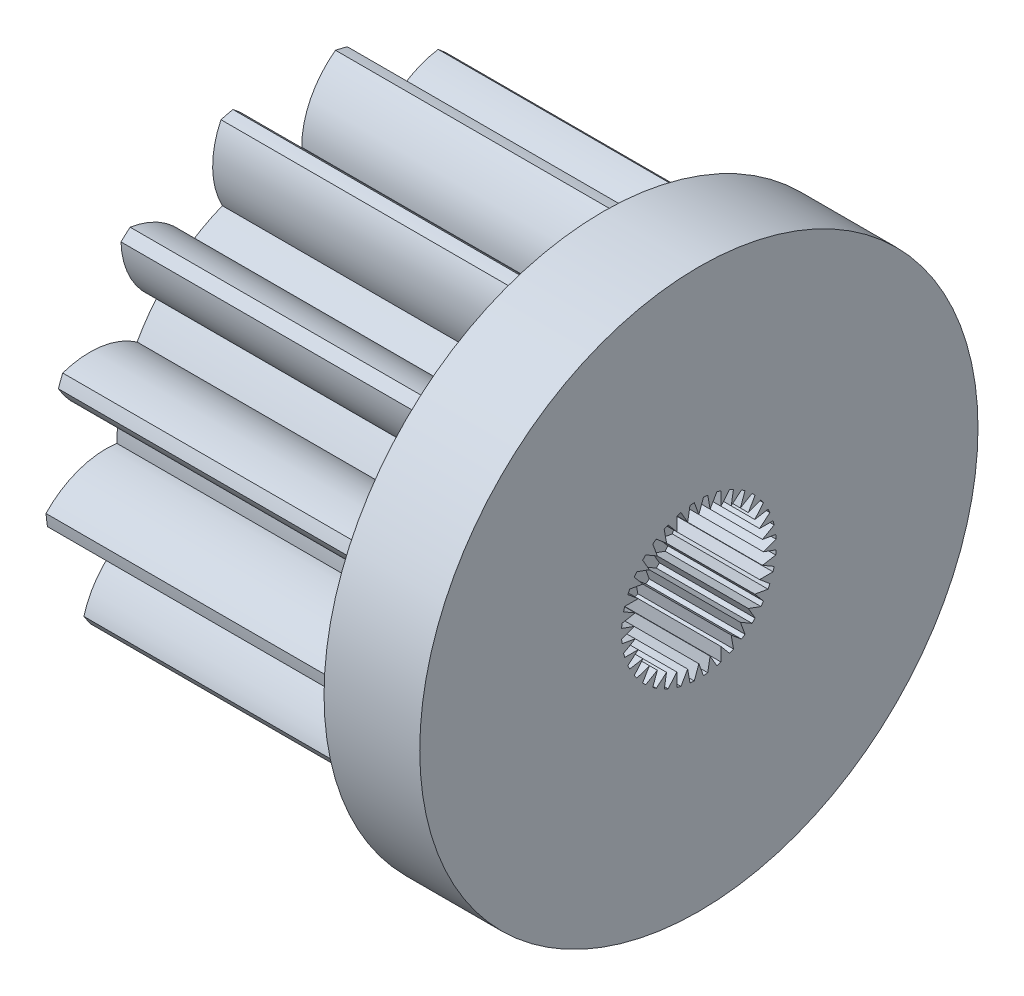
from build123d import *

# Parameters (mm, degrees)
SKETCH1_W                      = 3
SKETCH1_H                      = 8.75
BOSS_EXTRUDE1_DEPTH            = 10
CUT_EXTRUDE1_DEPTH             = 3
F_1_6_1_6_DIAMETER_HOLE1_D     = 1.6
F_1_6_1_6_DIAMETER_HOLE1_DEPTH = 13


with BuildPart() as part:
    # Sketch1 → Revolve1 (revolve)
    with BuildSketch(Plane(origin=(0, 0, 0), x_dir=(-1, 0, 0), z_dir=(0, 0, -1)), mode=Mode.PRIVATE) as revolve1_sk:
        with Locations((-11.5, 4.375)):
            Rectangle(SKETCH1_W, SKETCH1_H)
    revolve(revolve1_sk.sketch.rotate(Axis((13, 0, 0), (-1, 0, 0)), 270), axis=Axis((13, 0, 0), (-1, 0, 0)))

    # Sketch2 → Boss-Extrude1 (add)
    with BuildSketch(Plane.ZY.offset(-10)):
        with BuildLine():
            ThreePointArc((3.983306334, 3.41837266), (4.319842312, 2.981771856), (4.608733854, 2.512284471))
            ThreePointArc((4.608733854, 2.512284471), (5.736412412, 2.954786958), (6.942190227, 2.838308449))
            ThreePointArc((6.942190227, 2.838308449), (7.01262182, 2.659536653), (7.078450644, 2.479019256))
            ThreePointArc((7.078450644, 2.479019256), (6.253152529, 1.592255251), (5.115639582, 1.175683915))
            ThreePointArc((5.115639582, 1.175683915), (5.21072888, 0.632697035), (5.24834797, 0.082732007))
            ThreePointArc((5.24834797, 0.082732007), (6.452498904, -0.049509856), (7.466031873, -0.712999344))
            ThreePointArc((7.466031873, -0.712999344), (7.445316556, -0.904025102), (7.419714468, -1.094457498))
            ThreePointArc((7.419714468, -1.094457498), (6.276849497, -1.496112872), (5.076041451, -1.336339847))
            ThreePointArc((5.076041451, -1.336339847), (4.907900258, -1.861321052), (4.685628816, -2.365773362))
            ThreePointArc((4.685628816, -2.365773362), (5.690395658, -3.042464558), (6.279495593, -4.10096758))
            ThreePointArc((6.279495593, -4.10096758), (6.172378994, -4.2604856), (6.061211124, -4.41720723))
            ThreePointArc((6.061211124, -4.41720723), (4.862595889, -4.241739566), (3.873583397, -3.542224254))
            ThreePointArc((3.873583397, -3.542224254), (3.480730833, -3.928932917), (3.049488568, -4.272308565))
            ThreePointArc((3.049488568, -4.272308565), (3.624691343, -5.338427296), (3.654402549, -6.549453566))
            ThreePointArc((3.654402549, -6.549453566), (3.48542379, -6.640920192), (3.314157357, -6.728028018))
            ThreePointArc((3.314157357, -6.728028018), (2.334380164, -6.015634844), (1.783734068, -4.936627773))
            ThreePointArc((1.783734068, -4.936627773), (1.256167922, -5.0964736), (0.714747239, -5.200109363))
            ThreePointArc((0.714747239, -5.200109363), (0.728613924, -6.411420676), (0.192129921, -7.497538669))
            ThreePointArc((0.192129921, -7.497538669), (0, -7.5), (-0.192129921, -7.497538669))
            ThreePointArc((-0.192129921, -7.497538669), (-0.728613924, -6.411420676), (-0.714747239, -5.200109363))
            ThreePointArc((-0.714747239, -5.200109363), (-1.256167922, -5.0964736), (-1.783734068, -4.936627773))
            ThreePointArc((-1.783734068, -4.936627773), (-2.334380164, -6.015634844), (-3.314157357, -6.728028018))
            ThreePointArc((-3.314157357, -6.728028018), (-3.48542379, -6.640920192), (-3.654402549, -6.549453566))
            ThreePointArc((-3.654402549, -6.549453566), (-3.624691343, -5.338427296), (-3.049488568, -4.272308565))
            ThreePointArc((-3.049488568, -4.272308565), (-3.480730833, -3.928932917), (-3.873583397, -3.542224254))
            ThreePointArc((-3.873583397, -3.542224254), (-4.862595889, -4.241739566), (-6.061211124, -4.41720723))
            ThreePointArc((-6.061211124, -4.41720723), (-6.172378994, -4.2604856), (-6.279495593, -4.10096758))
            ThreePointArc((-6.279495593, -4.10096758), (-5.690395658, -3.042464558), (-4.685628816, -2.365773362))
            ThreePointArc((-4.685628816, -2.365773362), (-4.907900258, -1.861321052), (-5.076041451, -1.336339847))
            ThreePointArc((-5.076041451, -1.336339847), (-6.276849497, -1.496112872), (-7.419714468, -1.094457498))
            ThreePointArc((-7.419714468, -1.094457498), (-7.445316556, -0.904025102), (-7.466031873, -0.712999344))
            ThreePointArc((-7.466031873, -0.712999344), (-6.452498904, -0.049509856), (-5.24834797, 0.082732007))
            ThreePointArc((-5.24834797, 0.082732007), (-5.21072888, 0.632697035), (-5.115639582, 1.175683915))
            ThreePointArc((-5.115639582, 1.175683915), (-6.253152529, 1.592255251), (-7.078450644, 2.479019256))
            ThreePointArc((-7.078450644, 2.479019256), (-7.01262182, 2.659536653), (-6.942190227, 2.838308449))
            ThreePointArc((-6.942190227, 2.838308449), (-5.736412412, 2.954786958), (-4.608733854, 2.512284471))
            ThreePointArc((-4.608733854, 2.512284471), (-4.319842312, 2.981771856), (-3.983306334, 3.41837266))
            ThreePointArc((-3.983306334, 3.41837266), (-4.796933675, 4.315856884), (-5.115599083, 5.484582575))
            ThreePointArc((-5.115599083, 5.484582575), (-4.973419937, 5.613830611), (-4.827976462, 5.739393982))
            ThreePointArc((-4.827976462, 5.739393982), (-3.706182968, 5.282177689), (-2.913314353, 4.366302839))
            ThreePointArc((-2.913314353, 4.366302839), (-2.43933193, 4.647758679), (-1.93844561, 4.877953425))
            ThreePointArc((-1.93844561, 4.877953425), (-2.241795126, 6.050747718), (-1.980825421, 7.233694122))
            ThreePointArc((-1.980825421, 7.233694122), (-1.794867482, 7.282063631), (-1.607731473, 7.325653521))
            ThreePointArc((-1.607731473, 7.325653521), (-0.82691167, 6.399485168), (-0.550489643, 5.220053846))
            ThreePointArc((-0.550489643, 5.220053846), (0, 5.249), (0.550489643, 5.220053846))
            ThreePointArc((0.550489643, 5.220053846), (0.82691167, 6.399485168), (1.607731473, 7.325653521))
            ThreePointArc((1.607731473, 7.325653521), (1.794867482, 7.282063631), (1.980825421, 7.233694122))
            ThreePointArc((1.980825421, 7.233694122), (2.241795126, 6.050747718), (1.93844561, 4.877953425))
            ThreePointArc((1.93844561, 4.877953425), (2.43933193, 4.647758679), (2.913314353, 4.366302839))
            ThreePointArc((2.913314353, 4.366302839), (3.706182968, 5.282177689), (4.827976462, 5.739393982))
            ThreePointArc((4.827976462, 5.739393982), (4.973419937, 5.613830611), (5.115599083, 5.484582575))
            ThreePointArc((5.115599083, 5.484582575), (4.796933675, 4.315856884), (3.983306334, 3.41837266))
        make_face()
    extrude(amount=BOSS_EXTRUDE1_DEPTH)

    # Sketch3 → Cut-Extrude1 (cut)
    with BuildSketch(Plane(origin=(13, 0, 0), x_dir=(0, 0, -1), z_dir=(1, 0, 0))):
        with BuildLine():
            Line((0, -2.025), (0.14402993, -2.42071898))
            ThreePointArc((0.14402993, -2.42071898), (0.211352676, -2.415772143), (0.278511648, -2.408953354))
            Line((0.278511648, -2.408953354), (0.35163756, -1.9942357))
            Line((0.35163756, -1.9942357), (0.562195231, -2.358932284))
            ThreePointArc((0.562195231, -2.358932284), (0.627636184, -2.342370129), (0.69259079, -2.3239929))
            Line((0.69259079, -2.3239929), (0.69259079, -1.902877557))
            Line((0.69259079, -1.902877557), (0.963278515, -2.225470625))
            ThreePointArc((0.963278515, -2.225470625), (1.024849285, -2.197796384), (1.085625912, -2.168419097))
            Line((1.085625912, -2.168419097), (1.0125, -1.753701443))
            Line((1.0125, -1.753701443), (1.335093068, -2.024389167))
            ThreePointArc((1.335093068, -2.024389167), (1.390922858, -1.986443707), (1.44567484, -1.946958977))
            Line((1.44567484, -1.946958977), (1.30164491, -1.551239997))
            Line((1.30164491, -1.551239997), (1.666341494, -1.761797668))
            ThreePointArc((1.666341494, -1.761797668), (1.714733944, -1.714733944), (1.761797669, -1.666341494))
            Line((1.761797669, -1.666341494), (1.551239997, -1.30164491))
            Line((1.551239997, -1.30164491), (1.946958977, -1.445674839))
            ThreePointArc((1.946958977, -1.445674839), (1.986443707, -1.390922858), (2.024389167, -1.335093068))
            Line((2.024389167, -1.335093068), (1.753701443, -1.0125))
            Line((1.753701443, -1.0125), (2.168419097, -1.085625912))
            ThreePointArc((2.168419097, -1.085625912), (2.197796384, -1.024849285), (2.225470625, -0.963278515))
            Line((2.225470625, -0.963278515), (1.902877557, -0.69259079))
            Line((1.902877557, -0.69259079), (2.3239929, -0.69259079))
            ThreePointArc((2.3239929, -0.69259079), (2.342370129, -0.627636184), (2.358932284, -0.562195231))
            Line((2.358932284, -0.562195231), (1.9942357, -0.35163756))
            Line((1.9942357, -0.35163756), (2.408953354, -0.278511648))
            ThreePointArc((2.408953354, -0.278511648), (2.415772143, -0.211352676), (2.42071898, -0.14402993))
            Line((2.42071898, -0.14402993), (2.025, 0))
            Line((2.025, 0), (2.42071898, 0.14402993))
            ThreePointArc((2.42071898, 0.14402993), (2.415772143, 0.211352676), (2.408953354, 0.278511648))
            Line((2.408953354, 0.278511648), (1.9942357, 0.35163756))
            Line((1.9942357, 0.35163756), (2.358932284, 0.562195231))
            ThreePointArc((2.358932284, 0.562195231), (2.342370129, 0.627636184), (2.3239929, 0.69259079))
            Line((2.3239929, 0.69259079), (1.902877557, 0.69259079))
            Line((1.902877557, 0.69259079), (2.225470625, 0.963278515))
            ThreePointArc((2.225470625, 0.963278515), (2.197796384, 1.024849285), (2.168419097, 1.085625912))
            Line((2.168419097, 1.085625912), (1.753701443, 1.0125))
            Line((1.753701443, 1.0125), (2.024389167, 1.335093068))
            ThreePointArc((2.024389167, 1.335093068), (1.986443707, 1.390922858), (1.946958977, 1.445674839))
            Line((1.946958977, 1.445674839), (1.551239997, 1.30164491))
            Line((1.551239997, 1.30164491), (1.761797669, 1.666341494))
            ThreePointArc((1.761797669, 1.666341494), (1.714733944, 1.714733944), (1.666341494, 1.761797669))
            Line((1.666341494, 1.761797669), (1.30164491, 1.551239997))
            Line((1.30164491, 1.551239997), (1.445674839, 1.946958977))
            ThreePointArc((1.445674839, 1.946958977), (1.390922858, 1.986443707), (1.335093068, 2.024389167))
            Line((1.335093068, 2.024389167), (1.0125, 1.753701443))
            Line((1.0125, 1.753701443), (1.085625912, 2.168419097))
            ThreePointArc((1.085625912, 2.168419097), (1.024849285, 2.197796384), (0.963278515, 2.225470625))
            Line((0.963278515, 2.225470625), (0.69259079, 1.902877557))
            Line((0.69259079, 1.902877557), (0.69259079, 2.3239929))
            ThreePointArc((0.69259079, 2.3239929), (0.627636184, 2.342370129), (0.562195231, 2.358932284))
            Line((0.562195231, 2.358932284), (0.35163756, 1.9942357))
            Line((0.35163756, 1.9942357), (0.278511648, 2.408953354))
            ThreePointArc((0.278511648, 2.408953354), (0.211352676, 2.415772143), (0.14402993, 2.42071898))
            Line((0.14402993, 2.42071898), (0, 2.025))
            Line((0, 2.025), (-0.14402993, 2.42071898))
            ThreePointArc((-0.14402993, 2.42071898), (-0.211352676, 2.415772143), (-0.278511648, 2.408953354))
            Line((-0.278511648, 2.408953354), (-0.35163756, 1.9942357))
            Line((-0.35163756, 1.9942357), (-0.562195231, 2.358932284))
            ThreePointArc((-0.562195231, 2.358932284), (-0.627636184, 2.342370129), (-0.69259079, 2.3239929))
            Line((-0.69259079, 2.3239929), (-0.69259079, 1.902877557))
            Line((-0.69259079, 1.902877557), (-0.963278515, 2.225470625))
            ThreePointArc((-0.963278515, 2.225470625), (-1.024849285, 2.197796384), (-1.085625912, 2.168419097))
            Line((-1.085625912, 2.168419097), (-1.0125, 1.753701443))
            Line((-1.0125, 1.753701443), (-1.335093068, 2.024389167))
            ThreePointArc((-1.335093068, 2.024389167), (-1.390922858, 1.986443707), (-1.445674839, 1.946958977))
            Line((-1.445674839, 1.946958977), (-1.30164491, 1.551239997))
            Line((-1.30164491, 1.551239997), (-1.666341494, 1.761797669))
            ThreePointArc((-1.666341494, 1.761797669), (-1.714733944, 1.714733944), (-1.761797669, 1.666341494))
            Line((-1.761797669, 1.666341494), (-1.551239997, 1.30164491))
            Line((-1.551239997, 1.30164491), (-1.946958977, 1.445674839))
            ThreePointArc((-1.946958977, 1.445674839), (-1.986443707, 1.390922858), (-2.024389167, 1.335093068))
            Line((-2.024389167, 1.335093068), (-1.753701443, 1.0125))
            Line((-1.753701443, 1.0125), (-2.168419097, 1.085625912))
            ThreePointArc((-2.168419097, 1.085625912), (-2.197796384, 1.024849285), (-2.225470625, 0.963278515))
            Line((-2.225470625, 0.963278515), (-1.902877557, 0.69259079))
            Line((-1.902877557, 0.69259079), (-2.3239929, 0.69259079))
            ThreePointArc((-2.3239929, 0.69259079), (-2.342370129, 0.627636184), (-2.358932284, 0.562195231))
            Line((-2.358932284, 0.562195231), (-1.9942357, 0.35163756))
            Line((-1.9942357, 0.35163756), (-2.408953354, 0.278511648))
            ThreePointArc((-2.408953354, 0.278511648), (-2.415772143, 0.211352676), (-2.42071898, 0.14402993))
            Line((-2.42071898, 0.14402993), (-2.025, 0))
            Line((-2.025, 0), (-2.42071898, -0.14402993))
            ThreePointArc((-2.42071898, -0.14402993), (-2.415772143, -0.211352676), (-2.408953354, -0.278511648))
            Line((-2.408953354, -0.278511648), (-1.9942357, -0.35163756))
            Line((-1.9942357, -0.35163756), (-2.358932284, -0.562195231))
            ThreePointArc((-2.358932284, -0.562195231), (-2.342370129, -0.627636184), (-2.3239929, -0.69259079))
            Line((-2.3239929, -0.69259079), (-1.902877557, -0.69259079))
            Line((-1.902877557, -0.69259079), (-2.225470625, -0.963278515))
            ThreePointArc((-2.225470625, -0.963278515), (-2.197796384, -1.024849285), (-2.168419097, -1.085625912))
            Line((-2.168419097, -1.085625912), (-1.753701443, -1.0125))
            Line((-1.753701443, -1.0125), (-2.024389167, -1.335093068))
            ThreePointArc((-2.024389167, -1.335093068), (-1.986443707, -1.390922858), (-1.946958977, -1.445674839))
            Line((-1.946958977, -1.445674839), (-1.551239997, -1.30164491))
            Line((-1.551239997, -1.30164491), (-1.761797669, -1.666341494))
            ThreePointArc((-1.761797669, -1.666341494), (-1.714733944, -1.714733944), (-1.666341494, -1.761797669))
            Line((-1.666341494, -1.761797669), (-1.30164491, -1.551239997))
            Line((-1.30164491, -1.551239997), (-1.445674839, -1.946958977))
            ThreePointArc((-1.445674839, -1.946958977), (-1.390922858, -1.986443707), (-1.335093068, -2.024389167))
            Line((-1.335093068, -2.024389167), (-1.0125, -1.753701443))
            Line((-1.0125, -1.753701443), (-1.085625912, -2.168419097))
            ThreePointArc((-1.085625912, -2.168419097), (-1.024849285, -2.197796384), (-0.963278515, -2.225470625))
            Line((-0.963278515, -2.225470625), (-0.69259079, -1.902877557))
            Line((-0.69259079, -1.902877557), (-0.69259079, -2.3239929))
            ThreePointArc((-0.69259079, -2.3239929), (-0.627636184, -2.342370129), (-0.562195231, -2.358932284))
            Line((-0.562195231, -2.358932284), (-0.35163756, -1.9942357))
            Line((-0.35163756, -1.9942357), (-0.278511648, -2.408953354))
            ThreePointArc((-0.278511648, -2.408953354), (-0.211352676, -2.415772143), (-0.14402993, -2.42071898))
            Line((-0.14402993, -2.42071898), (0, -2.025))
        make_face()
    extrude(amount=-CUT_EXTRUDE1_DEPTH, mode=Mode.SUBTRACT)

    # Ø1.6 (1.6) Diameter Hole1
    with Locations(Plane.ZY):
        with Locations((0, 0)):
            Hole(F_1_6_1_6_DIAMETER_HOLE1_D / 2, depth=F_1_6_1_6_DIAMETER_HOLE1_DEPTH)


solid = part.part
